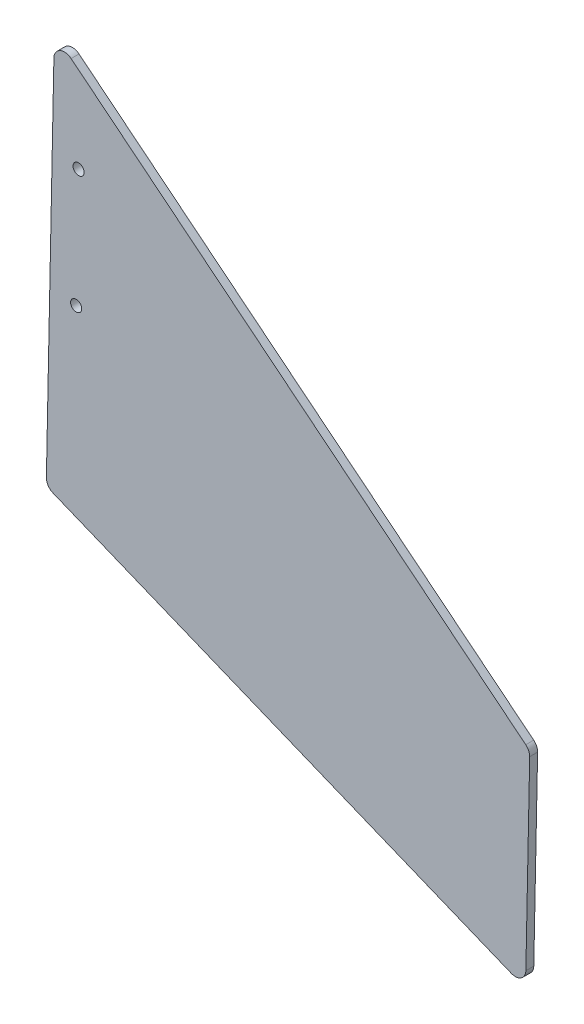
from build123d import *

# Parameters (mm, degrees)
EXTRUDE_1_DEPTH     = 3
FILLET_1_R          = 4
SKETCH_2_R          = 2.1
CUT_EXTRUDE_1_DEPTH = 3


with BuildPart() as part:
    # Эскиз1 → Бобышка-Вытянуть1 (new body)
    with BuildSketch(Plane.XY):
        Polygon((0, 0), (-3.068659699, -150), (178.455758645, -224), (180.065729767, -145.302558134), align=None)
    extrude(amount=EXTRUDE_1_DEPTH)

    # Скругление1
    fillet_1_edges = [part.edges().sort_by_distance(p)[0] for p in [
        (178.455758645, -224, 1.5),
        (-3.068659699, -150, 1.5),
        (0, 0, 1.5),
        (180.065729767, -145.302558134, 1.5),
    ]]
    fillet(fillet_1_edges, radius=FILLET_1_R)

    # Эскиз2 → Вырез-Вытянуть1 (cut)
    with BuildSketch(Plane.XY.offset(3)):
        with Locations((9.183783122, -40)):
            Circle(SKETCH_2_R)
        with Locations((8.259287105, -85.190544444)):
            Circle(SKETCH_2_R)
    extrude(amount=-CUT_EXTRUDE_1_DEPTH, mode=Mode.SUBTRACT)


solid = part.part
